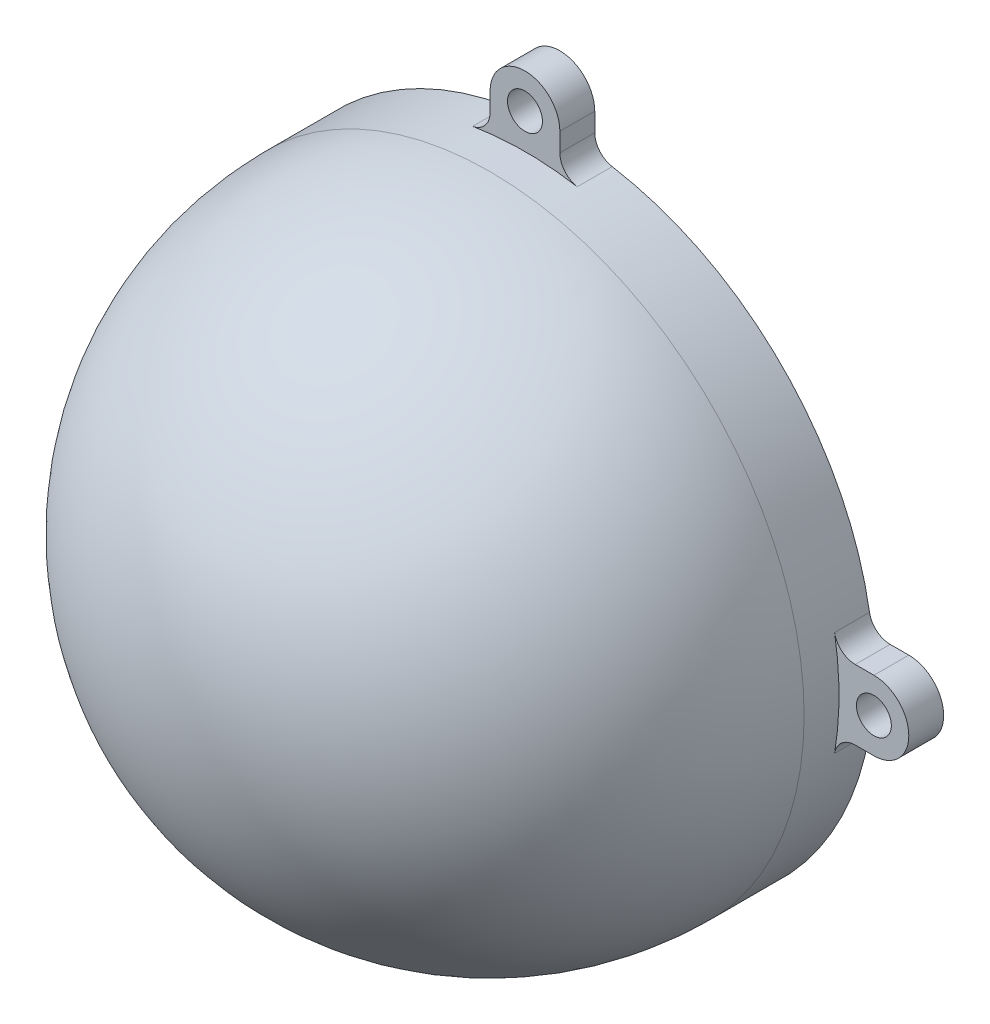
from build123d import *

# Parameters (mm, degrees)
SKETCH1_R                = 45
SKETCH1_R_2              = 42.5
BOSS_EXTRUDE1_DEPTH      = 10
SKETCH4_R                = 2.5
BOSS_EXTRUDE2_DEPTH      = 5
FILLET1_R                = 3
CIRPATTERN1_COUNT        = 4
FILLET1_OF_CIRPATTERN1_R = 3


with BuildPart() as part:
    # Sketch1 → Boss-Extrude1 (new body)
    with BuildSketch(Plane.XY):
        Circle(SKETCH1_R)
        Circle(SKETCH1_R_2, mode=Mode.SUBTRACT)
    extrude(amount=BOSS_EXTRUDE1_DEPTH)

    # Sketch3 → Revolve1 (revolve)
    with BuildSketch(Plane(origin=(0, 0, 0), x_dir=(0, 0, -1), z_dir=(1, 0, 0))):
        with BuildLine():
            Line((-55, 0), (-52.5, 0))
            ThreePointArc((-52.5, 0), (-40.0520382, -30.0520382), (-10, -42.5))
            Line((-10, -42.5), (-10, -45))
            ThreePointArc((-10, -45), (-41.819805153, -31.819805153), (-55, 0))
        make_face()
    revolve(axis=Axis((0, 0, 55), (0, 0, -1)))

    # Sketch4 → Boss-Extrude2 (add)
    with BuildSketch(Plane.XY):
        with BuildLine():
            Line((5, 44.72135955), (5, 50))
            ThreePointArc((5, 50), (0, 55), (-5, 50))
            Line((-5, 50), (-5, 44.72135955))
            ThreePointArc((-5, 44.72135955), (0, 45), (5, 44.72135955))
        make_face()
        with Locations((0, 50)):
            Circle(SKETCH4_R, mode=Mode.SUBTRACT)
    boss_extrude2 = extrude(amount=BOSS_EXTRUDE2_DEPTH)

    # Fillet1
    fillet1_edges = [part.edges().sort_by_distance(p)[0] for p in [
        (-5, 44.72135955, 2.5),
        (5, 44.72135955, 2.5),
    ]]
    fillet(fillet1_edges, radius=FILLET1_R)

    # CirPattern1: Boss-Extrude2 ×4 about axis
    cirpattern1_axis = Axis((0, 0, 0), (0, 0, 1))
    for i in range(1, CIRPATTERN1_COUNT):
        add(boss_extrude2.rotate(cirpattern1_axis, i * 360 / CIRPATTERN1_COUNT))

    # Fillet1 of CirPattern1
    fillet1_of_cirpattern1_edges = [part.edges().sort_by_distance(p)[0] for p in [
        (-44.72135955, -5, 2.5),
        (-44.72135955, 5, 2.5),
        (5, -44.72135955, 2.5),
        (-5, -44.72135955, 2.5),
        (44.72135955, 5, 2.5),
        (44.72135955, -5, 2.5),
    ]]
    fillet(fillet1_of_cirpattern1_edges, radius=FILLET1_OF_CIRPATTERN1_R)


solid = part.part
